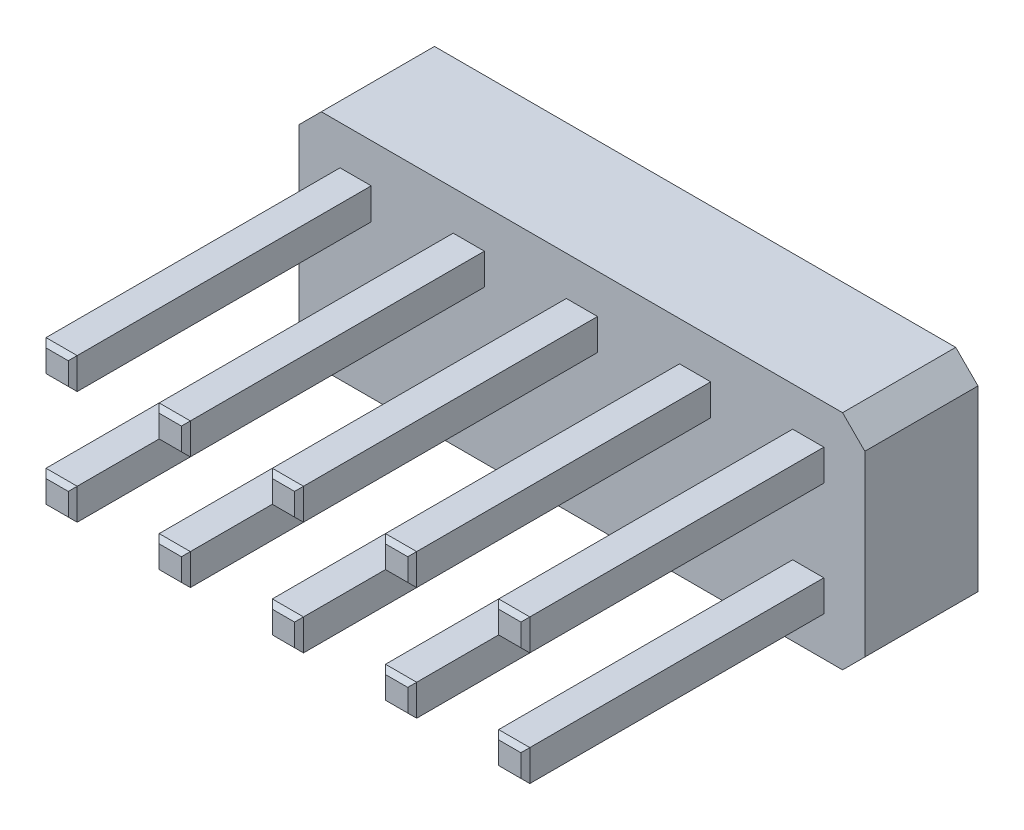
from build123d import *

# Parameters (mm, degrees)
SKETCH1_W           = 12.7
SKETCH1_H           = 5
BOSS_EXTRUDE1_DEPTH = 2.54
SKETCH2_W           = 0.7
SKETCH2_H           = 0.7
BOSS_EXTRUDE2_DEPTH = 6.7
CHAMFER1_SIZE       = 0.5
CHAMFER2_SIZE       = 0.1


with BuildPart() as part:
    # Sketch1 → Boss-Extrude1 (new body)
    with BuildSketch(Plane.XY):
        Rectangle(SKETCH1_W, SKETCH1_H)
    extrude(amount=BOSS_EXTRUDE1_DEPTH)

    # Sketch2 → Boss-Extrude2 (add)
    with BuildSketch(Plane.XY.offset(2.54)):
        with Locations((-2.54, 1.27)):
            Rectangle(SKETCH2_W, SKETCH2_H)
        with Locations((-5.08, 1.27)):
            Rectangle(SKETCH2_W, SKETCH2_H)
        with Locations((0, 1.27)):
            Rectangle(SKETCH2_W, SKETCH2_H)
        with Locations((2.54, 1.27)):
            Rectangle(SKETCH2_W, SKETCH2_H)
        with Locations((5.08, 1.27)):
            Rectangle(SKETCH2_W, SKETCH2_H)
        with Locations((-2.54, -1.27)):
            Rectangle(SKETCH2_W, SKETCH2_H)
        with Locations((0, -1.27)):
            Rectangle(SKETCH2_W, SKETCH2_H)
        with Locations((2.54, -1.27)):
            Rectangle(SKETCH2_W, SKETCH2_H)
        with Locations((5.08, -1.27)):
            Rectangle(SKETCH2_W, SKETCH2_H)
        with Locations((-5.08, -1.27)):
            Rectangle(SKETCH2_W, SKETCH2_H)
    extrude(amount=BOSS_EXTRUDE2_DEPTH)

    # Chamfer1
    chamfer1_edges = [part.edges().sort_by_distance(p)[0] for p in [
        (6.35, -2.5, 1.27),
        (-6.35, -2.5, 1.27),
        (-6.35, 2.5, 1.27),
        (6.35, 2.5, 1.27),
    ]]
    chamfer(chamfer1_edges, length=CHAMFER1_SIZE)

    # Chamfer2
    chamfer2_edges = [part.edges().sort_by_distance(p)[0] for p in [
        (4.73, -1.27, 9.24),
        (5.08, -1.62, 9.24),
        (5.43, -1.27, 9.24),
        (5.08, -0.92, 9.24),
        (-5.08, -1.62, 9.24),
        (-4.73, -1.27, 9.24),
        (-5.08, -0.92, 9.24),
        (-5.43, -1.27, 9.24),
        (-5.43, 1.27, 9.24),
        (-5.08, 0.92, 9.24),
        (-4.73, 1.27, 9.24),
        (-5.08, 1.62, 9.24),
        (-2.89, 1.27, 9.24),
        (-2.54, 0.92, 9.24),
        (-2.19, 1.27, 9.24),
        (-2.54, 1.62, 9.24),
        (-0.35, 1.27, 9.24),
        (0, 0.92, 9.24),
        (0.35, 1.27, 9.24),
        (0, 1.62, 9.24),
        (2.19, 1.27, 9.24),
        (2.54, 0.92, 9.24),
        (2.89, 1.27, 9.24),
        (2.54, 1.62, 9.24),
        (4.73, 1.27, 9.24),
        (5.08, 0.92, 9.24),
        (5.43, 1.27, 9.24),
        (5.08, 1.62, 9.24),
        (-2.89, -1.27, 9.24),
        (-2.54, -1.62, 9.24),
        (-2.19, -1.27, 9.24),
        (-2.54, -0.92, 9.24),
        (-0.35, -1.27, 9.24),
        (0, -1.62, 9.24),
        (0.35, -1.27, 9.24),
        (0, -0.92, 9.24),
        (2.19, -1.27, 9.24),
        (2.54, -1.62, 9.24),
        (2.89, -1.27, 9.24),
        (2.54, -0.92, 9.24),
    ]]
    chamfer(chamfer2_edges, length=CHAMFER2_SIZE)


solid = part.part
